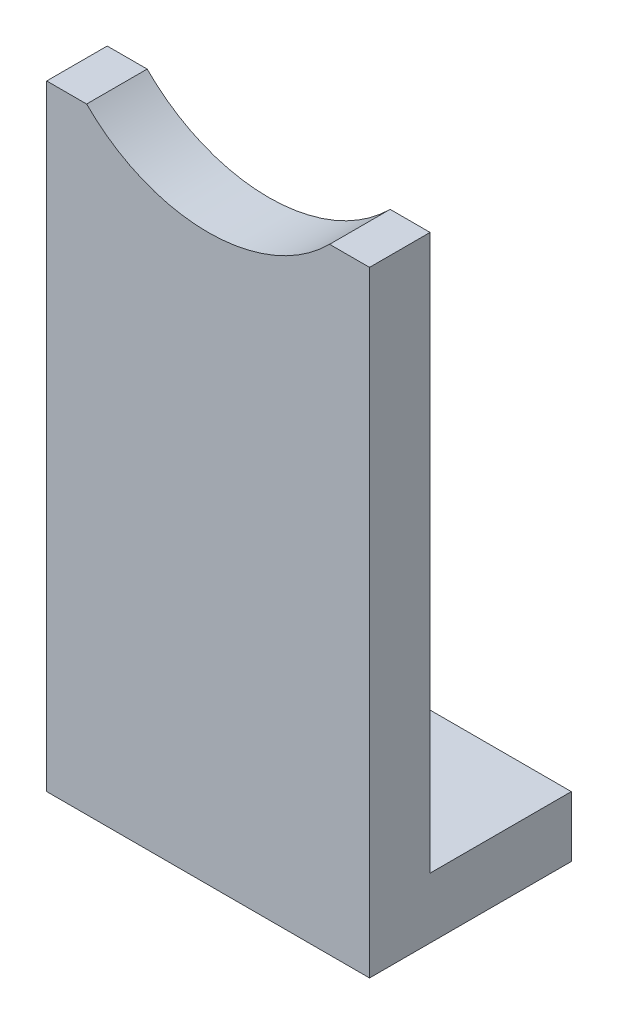
from build123d import *

# Parameters (mm, degrees)
SKETCH_1_W          = 32
SKETCH_1_H          = 20
EXTRUDE_1_DEPTH     = 6
SKETCH_2_W          = 32
SKETCH_2_H          = 6
EXTRUDE_2_DEPTH     = 55
SKETCH_3_R          = 17
CUT_EXTRUDE_1_DEPTH = 55


with BuildPart() as part:
    # 草图1 → 凸台-拉伸1 (new body)
    with BuildSketch(Plane(origin=(0, 0, 0), x_dir=(1, 0, 0), z_dir=(0, 1, 0))):
        with Locations((0, 11.560693642)):
            Rectangle(SKETCH_1_W, SKETCH_1_H)
    extrude(amount=EXTRUDE_1_DEPTH)

    # 草图2 → 凸台-拉伸2 (add)
    with BuildSketch(Plane(origin=(0, 6, 0), x_dir=(1, 0, 0), z_dir=(0, 1, 0))):
        with Locations((0, 4.560693642)):
            Rectangle(SKETCH_2_W, SKETCH_2_H)
    extrude(amount=EXTRUDE_2_DEPTH)

    # 草图3 → 切除-拉伸1 (cut)
    with BuildSketch(Plane.XY.offset(-1.560693642)):
        with Locations((0, 73)):
            Circle(SKETCH_3_R)
    extrude(amount=-CUT_EXTRUDE_1_DEPTH, mode=Mode.SUBTRACT)


solid = part.part
